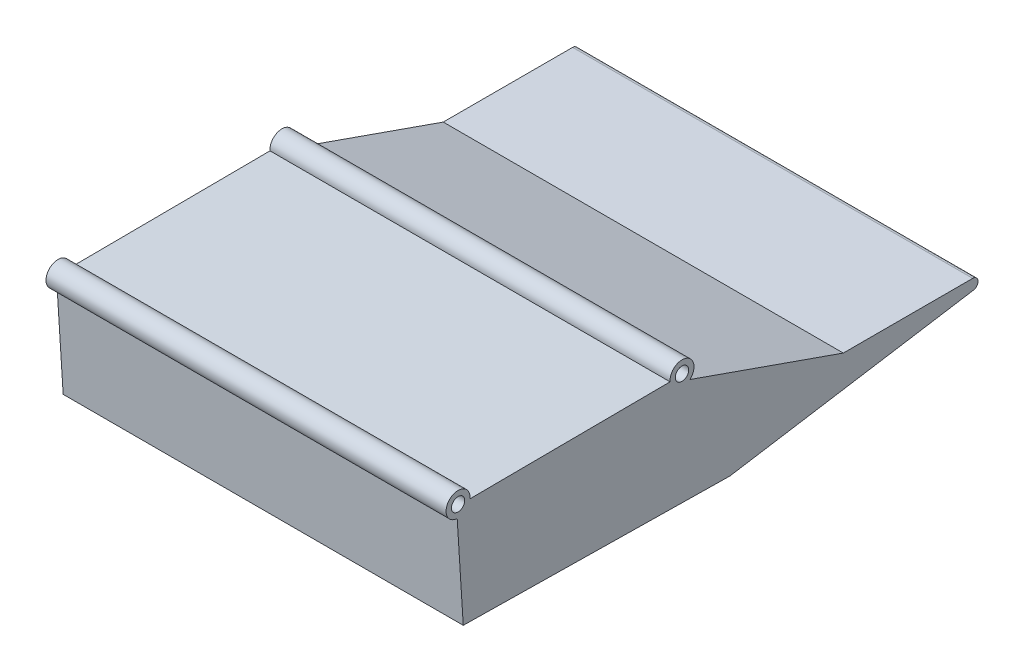
from build123d import *

# Parameters (mm, degrees)
ESBO_O1_R                = 2.5
RESSALTO_EXTRUS_O1_DEPTH = 75
FILETE1_R                = 2


with BuildPart() as part:
    # Esboço1 → Ressalto-extrusão1 (new, symmetric)
    with BuildSketch(Plane(origin=(0, 0, 0), x_dir=(0, 0, -1), z_dir=(1, 0, 0))):
        with BuildLine():
            Line((-100, -17.848056111), (0, -19.347346796))
            Line((0, -19.347346796), (116.020534247, -0.683058506))
            Line((116.020534247, -0.683058506), (42.496745606, -0.683058506))
            Line((42.496745606, -0.683058506), (-15.006508788, 19.480520471))
            ThreePointArc((-15.006508788, 19.480520471), (-16.311915051, 27.040473041), (-22.459012532, 22.450248543))
            Line((-22.459012532, 22.450248543), (-97.460720141, 21.975419182))
            ThreePointArc((-97.460720141, 21.975419182), (-104.830140039, 25.877112836), (-102.267981422, 17.941943889))
            Line((-102.267981422, 17.941943889), (-100, -17.848056111))
        make_face()
        with Locations((-101.937720305, 22.42980837)):
            Circle(ESBO_O1_R, mode=Mode.SUBTRACT)
        with Locations((-17.977720305, 22.860150942)):
            Circle(ESBO_O1_R, mode=Mode.SUBTRACT)
    extrude(amount=RESSALTO_EXTRUS_O1_DEPTH, both=True)

    # Filete1
    filete1_edges = [part.edges().sort_by_distance(p)[0] for p in [
        (0, -0.683058506, -116.020534247),
    ]]
    fillet(filete1_edges, radius=FILETE1_R)


solid = part.part
